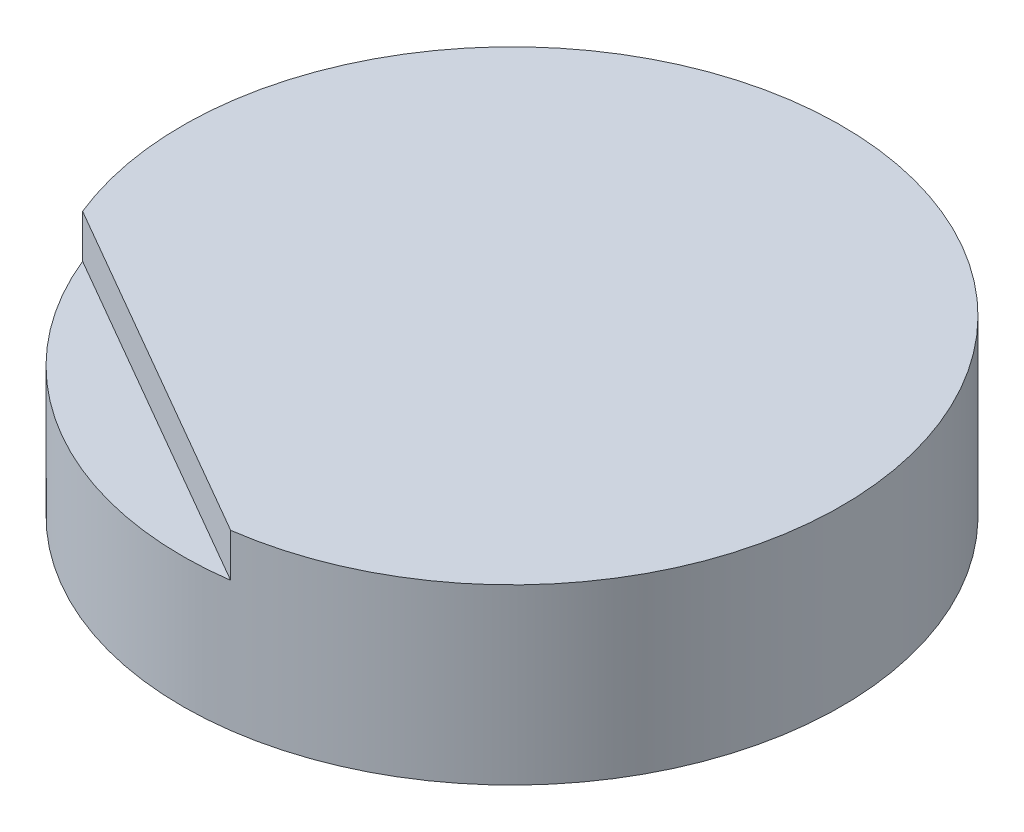
from build123d import *

# Parameters (mm, degrees)
KEYED_BACK_DEPTH   = 0.5
CUP_BLANK_SKETCH_R = 3.8
CUP_BLANK_DEPTH    = 1.5


with BuildPart() as part:
    # Keyed Back Sketch → Keyed Back (new body)
    with BuildSketch(Plane(origin=(0, -69, 0), x_dir=(-1, 0, 0), z_dir=(0, -1, 0))):
        with BuildLine():
            Line((70.771750258, -29.745028704), (74.811552234, -27.412647946))
            ThreePointArc((74.811552234, -27.412647946), (69.391651246, -22.689865579), (70.771750258, -29.745028704))
        make_face()
    extrude(amount=KEYED_BACK_DEPTH)

    # Cup Blank Sketch → Cup Blank (add)
    with BuildSketch(Plane(origin=(0, -69.5, 0), x_dir=(-1, 0, 0), z_dir=(0, -1, 0))):
        with Locations(Location((71.291651246, -25.980762114, 0), (0, 0, 262.136353638))):
            Circle(CUP_BLANK_SKETCH_R)
    extrude(amount=CUP_BLANK_DEPTH)

    # Spherical Bearing Seat profile → Spherical Bearing Seat (revolve, cut)
    with BuildSketch(Plane(origin=(0, -73, 0), x_dir=(-1, 0, 0), z_dir=(0, -1, 0))):
        with BuildLine():
            Line((71.291651246, -29.080762114), (71.291651246, -22.880762114))
            ThreePointArc((71.291651246, -22.880762114), (68.191651246, -25.980762114), (71.291651246, -29.080762114))
        make_face()
    revolve(axis=Axis((-71.291651246, -73, 15.980762114), (0, 0, 1)), mode=Mode.SUBTRACT)


solid = part.part
